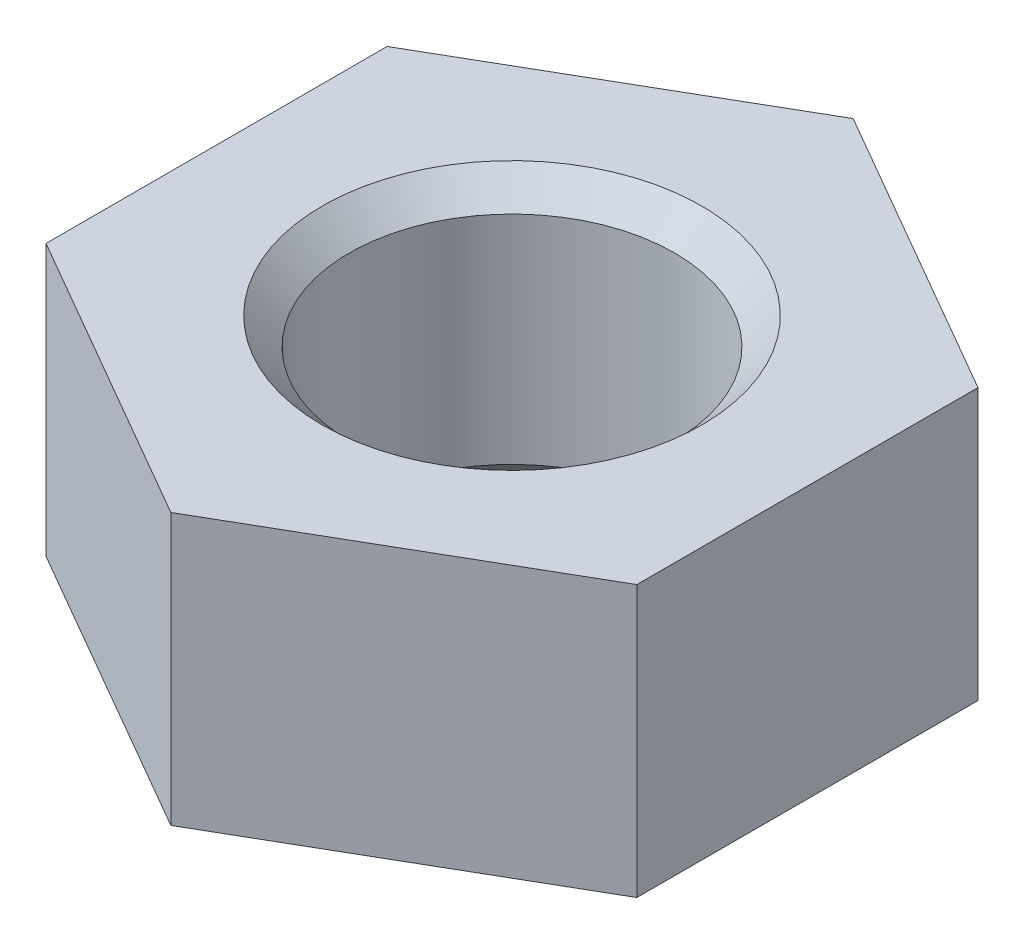
from build123d import *

# Parameters (mm, degrees)
SKETCH2_R           = 1.5
BOSS_EXTRUDE1_DEPTH = 1.25
CHAMFER1_SIZE       = 0.25


with BuildPart() as part:
    # Sketch2 → Boss-Extrude1 (new, symmetric)
    with BuildSketch(Plane(origin=(0, 0, 0), x_dir=(1, 0, 0), z_dir=(0, 1, 0))):
        Polygon((-2.725, 1.573279484), (-2.725, -1.573279484), (0, -3.146558967), (2.725, -1.573279484), (2.725, 1.573279484), (0, 3.146558967), align=None)
        with Locations(Location((0, 0, 0), (0, 0, 270))):
            Circle(SKETCH2_R, mode=Mode.SUBTRACT)
    extrude(amount=BOSS_EXTRUDE1_DEPTH, both=True)

    # Chamfer1
    chamfer1_edges = [part.edges().sort_by_distance(p)[0] for p in [
        (0, -1.25, -1.5),
        (0, 1.25, -1.5),
    ]]
    chamfer(chamfer1_edges, length=CHAMFER1_SIZE)


solid = part.part
